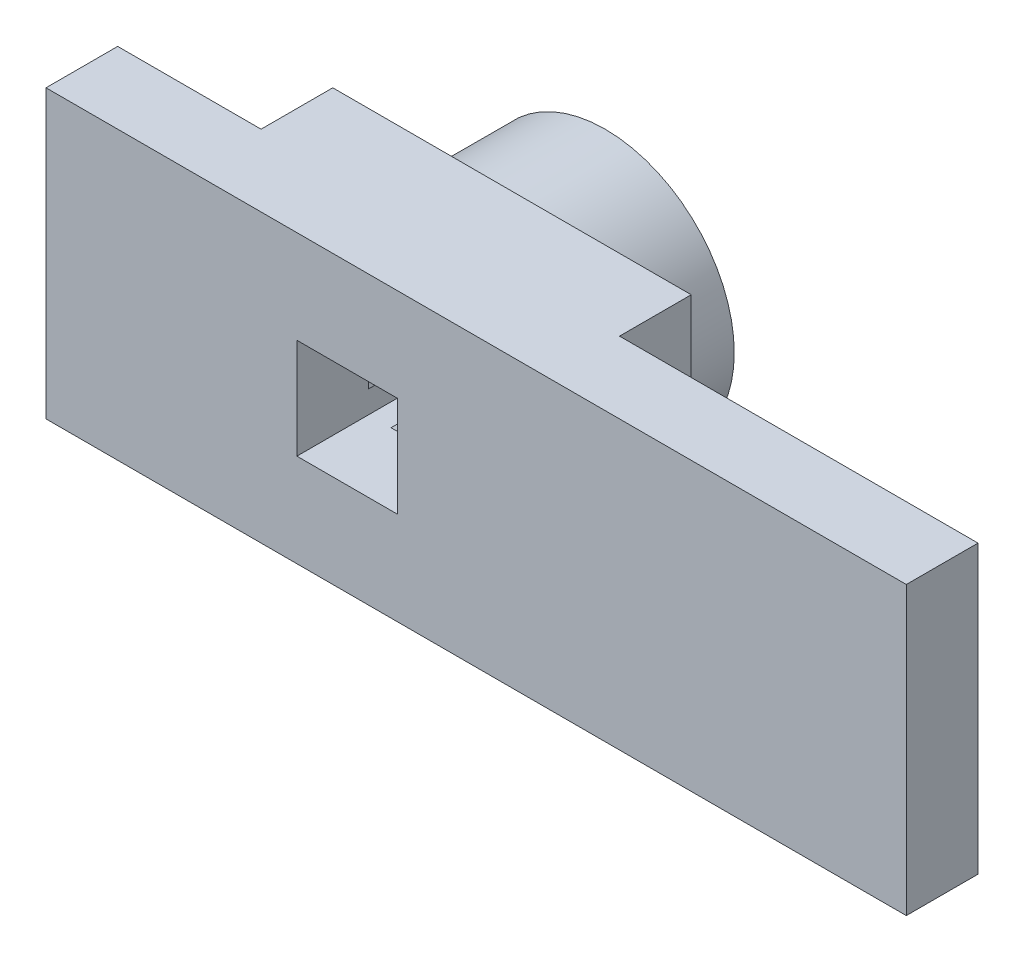
from build123d import *

# Parameters (mm, degrees)
SKETCH1_W           = 60
SKETCH1_H           = 20
BOSS_EXTRUDE1_DEPTH = 10
SKETCH2_W           = 7
SKETCH2_H           = 7
CUT_EXTRUDE1_DEPTH  = 10
SKETCH3_W           = 25
SKETCH3_H           = 5
SKETCH3_W_2         = 10
CUT_EXTRUDE2_DEPTH  = 65.031242374
SKETCH5_R           = 9
BOSS_EXTRUDE2_DEPTH = 8
SKETCH6_R           = 6.51
CUT_EXTRUDE3_DEPTH  = 5
SKETCH7_R           = 4
CUT_EXTRUDE4_DEPTH  = 8


with BuildPart() as part:
    # Sketch1 → Boss-Extrude1 (new body)
    with BuildSketch(Plane.XY):
        with Locations((-30, 10)):
            Rectangle(SKETCH1_W, SKETCH1_H)
    extrude(amount=BOSS_EXTRUDE1_DEPTH)

    # Sketch2 → Cut-Extrude1 (cut)
    with BuildSketch(Plane.XY.offset(10)):
        with Locations((-39, 10)):
            Rectangle(SKETCH2_W, SKETCH2_H)
    extrude(amount=-CUT_EXTRUDE1_DEPTH, mode=Mode.SUBTRACT)

    # Sketch3 → Cut-Extrude2 (cut, through all)
    with BuildSketch(Plane(origin=(0, 0, 0), x_dir=(-1, 0, 0), z_dir=(0, -1, 0))):
        with Locations((12.5, -2.5)):
            Rectangle(SKETCH3_W, SKETCH3_H)
        with Locations((55, -2.5)):
            Rectangle(SKETCH3_W_2, SKETCH3_H)
    extrude(amount=-CUT_EXTRUDE2_DEPTH, mode=Mode.SUBTRACT)

    # Sketch5 → Boss-Extrude2 (add)
    with BuildSketch(Plane(origin=(0, 0, 0), x_dir=(-1, 0, 0), z_dir=(0, 0, -1))):
        with Locations(Location((39, 10, 0), (0, 0, 180))):
            Circle(SKETCH5_R)
    extrude(amount=BOSS_EXTRUDE2_DEPTH)

    # Sketch6 → Cut-Extrude3 (cut)
    with BuildSketch(Plane(origin=(0, 0, -8), x_dir=(-1, 0, 0), z_dir=(0, 0, -1))):
        with Locations((39, 10)):
            Circle(SKETCH6_R)
    extrude(amount=-CUT_EXTRUDE3_DEPTH, mode=Mode.SUBTRACT)

    # Sketch7 → Cut-Extrude4 (cut)
    with BuildSketch(Plane(origin=(0, 0, -3), x_dir=(-1, 0, 0), z_dir=(0, 0, -1))):
        with Locations((39, 10)):
            Circle(SKETCH7_R)
    extrude(amount=-CUT_EXTRUDE4_DEPTH, mode=Mode.SUBTRACT)


solid = part.part
